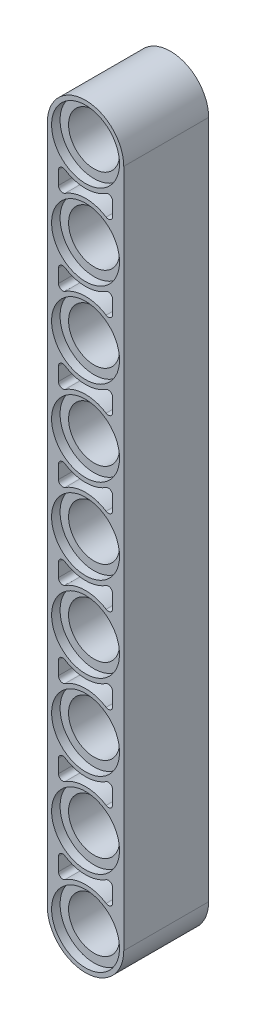
from build123d import *

# Parameters (mm, degrees)
EXTRUDE1_DEPTH      = 254
EXTRUDE1_DEPTH_BACK = 254
SKETCH108_R         = 152.4
CUT_EXTRUDE1_DEPTH  = 508
SKETCH109_R         = 203.2
CUT_EXTRUDE2_DEPTH  = 50.8
CUT_EXTRUDE3_START  = -203.2
CUT_EXTRUDE3_DEPTH  = 203.2
CUT_EXTRUDE4_START  = -457.2
SKETCH111_R         = 203.2
CUT_EXTRUDE4_DEPTH  = 50.8
CUT_EXTRUDE5_START  = -508
CUT_EXTRUDE5_DEPTH  = 203.2
SCALE1_SCALE        = 0.01574803


with BuildPart() as part:
    # Sketch107 → Extrude1 (new, two sides: drawn at the far end of the back side and taken through both)
    with BuildSketch(Plane.XY.offset(-EXTRUDE1_DEPTH_BACK)):
        with BuildLine():
            Line((-228.6, 2032), (-228.6, -2032))
            ThreePointArc((-228.6, -2032), (0, -2260.6), (228.6, -2032))
            Line((228.6, -2032), (228.6, 2032))
            ThreePointArc((228.6, 2032), (0, 2260.6), (-228.6, 2032))
        make_face()
    extrude(amount=EXTRUDE1_DEPTH + EXTRUDE1_DEPTH_BACK)

    # Sketch108 → Cut-Extrude1 (cut)
    with BuildSketch(Plane.XY.offset(254)):
        Circle(SKETCH108_R)
        with Locations((0, 508)):
            Circle(SKETCH108_R)
        with Locations((0, 1016)):
            Circle(SKETCH108_R)
        with Locations((0, 1524)):
            Circle(SKETCH108_R)
        with Locations((0, 2032)):
            Circle(SKETCH108_R)
        with Locations(Location((0, -2032, 0), (0, 0, 180))):
            Circle(SKETCH108_R)
        with Locations(Location((0, -1524, 0), (0, 0, 180))):
            Circle(SKETCH108_R)
        with Locations(Location((0, -1016, 0), (0, 0, 180))):
            Circle(SKETCH108_R)
        with Locations(Location((0, -508, 0), (0, 0, 180))):
            Circle(SKETCH108_R)
    extrude(amount=-CUT_EXTRUDE1_DEPTH, mode=Mode.SUBTRACT)

    # Sketch109 → Cut-Extrude2 (cut)
    with BuildSketch(Plane.XY.offset(254)):
        Circle(SKETCH109_R)
        with Locations((0, 508)):
            Circle(SKETCH109_R)
        with Locations((0, 1016)):
            Circle(SKETCH109_R)
        with Locations((0, 1524)):
            Circle(SKETCH109_R)
        with Locations((0, 2032)):
            Circle(SKETCH109_R)
        with Locations(Location((0, -2032, 0), (0, 0, 180))):
            Circle(SKETCH109_R)
        with Locations(Location((0, -1524, 0), (0, 0, 180))):
            Circle(SKETCH109_R)
        with Locations(Location((0, -1016, 0), (0, 0, 180))):
            Circle(SKETCH109_R)
        with Locations(Location((0, -508, 0), (0, 0, 180))):
            Circle(SKETCH109_R)
    extrude(amount=-CUT_EXTRUDE2_DEPTH, mode=Mode.SUBTRACT)

    # Sketch110 → Cut-Extrude3 (cut)
    with BuildSketch(Plane.XY.offset(254).offset(CUT_EXTRUDE3_START)):
        with BuildLine():
            Line((-162, -1817.858831609), (-162, -1738.141168391))
            ThreePointArc((-162, -1738.141168391), (-148.810569192, -1715.868719042), (-122.94, -1716.727051552))
            ThreePointArc((-122.94, -1716.727051552), (0, -1752.6), (122.94, -1716.727051552))
            ThreePointArc((122.94, -1716.727051552), (148.810569192, -1715.868719042), (162, -1738.141168391))
            Line((162, -1738.141168391), (162, -1817.858831609))
            ThreePointArc((162, -1817.858831609), (148.810569192, -1840.131280958), (122.94, -1839.272948448))
            ThreePointArc((122.94, -1839.272948448), (0, -1803.4), (-122.94, -1839.272948448))
            ThreePointArc((-122.94, -1839.272948448), (-148.810569192, -1840.131280958), (-162, -1817.858831609))
        make_face()
        with BuildLine():
            Line((162, -1309.858831609), (162, -1230.141168391))
            ThreePointArc((162, -1230.141168391), (148.810569192, -1207.868719042), (122.94, -1208.727051552))
            ThreePointArc((122.94, -1208.727051552), (0, -1244.6), (-122.94, -1208.727051552))
            ThreePointArc((-122.94, -1208.727051552), (-148.810569192, -1207.868719042), (-162, -1230.141168391))
            Line((-162, -1230.141168391), (-162, -1309.858831609))
            ThreePointArc((-162, -1309.858831609), (-148.810569192, -1332.131280958), (-122.94, -1331.272948448))
            ThreePointArc((-122.94, -1331.272948448), (0, -1295.4), (122.94, -1331.272948448))
            ThreePointArc((122.94, -1331.272948448), (148.810569192, -1332.131280958), (162, -1309.858831609))
        make_face()
        with BuildLine():
            Line((-162, 214.141168391), (-162, 293.858831609))
            ThreePointArc((-162, 293.858831609), (-148.810569192, 316.131280958), (-122.94, 315.272948448))
            ThreePointArc((-122.94, 315.272948448), (0, 279.4), (122.94, 315.272948448))
            ThreePointArc((122.94, 315.272948448), (148.810569192, 316.131280958), (162, 293.858831609))
            Line((162, 293.858831609), (162, 214.141168391))
            ThreePointArc((162, 214.141168391), (148.810569192, 191.868719042), (122.94, 192.727051552))
            ThreePointArc((122.94, 192.727051552), (0, 228.6), (-122.94, 192.727051552))
            ThreePointArc((-122.94, 192.727051552), (-148.810569192, 191.868719042), (-162, 214.141168391))
        make_face()
        with BuildLine():
            Line((-162, -722.141168391), (-162, -801.858831609))
            ThreePointArc((-162, -801.858831609), (-148.810569192, -824.131280958), (-122.94, -823.272948448))
            ThreePointArc((-122.94, -823.272948448), (0, -787.4), (122.94, -823.272948448))
            ThreePointArc((122.94, -823.272948448), (148.810569192, -824.131280958), (162, -801.858831609))
            Line((162, -801.858831609), (162, -722.141168391))
            ThreePointArc((162, -722.141168391), (148.810569192, -699.868719042), (122.94, -700.727051552))
            ThreePointArc((122.94, -700.727051552), (0, -736.6), (-122.94, -700.727051552))
            ThreePointArc((-122.94, -700.727051552), (-148.810569192, -699.868719042), (-162, -722.141168391))
        make_face()
        with BuildLine():
            Line((162, -214.141168391), (162, -293.858831609))
            ThreePointArc((162, -293.858831609), (148.810569192, -316.131280958), (122.94, -315.272948448))
            ThreePointArc((122.94, -315.272948448), (0, -279.4), (-122.94, -315.272948448))
            ThreePointArc((-122.94, -315.272948448), (-148.810569192, -316.131280958), (-162, -293.858831609))
            Line((-162, -293.858831609), (-162, -214.141168391))
            ThreePointArc((-162, -214.141168391), (-148.810569192, -191.868719042), (-122.94, -192.727051552))
            ThreePointArc((-122.94, -192.727051552), (0, -228.6), (122.94, -192.727051552))
            ThreePointArc((122.94, -192.727051552), (148.810569192, -191.868719042), (162, -214.141168391))
        make_face()
        with BuildLine():
            Line((162, 722.141168391), (162, 801.858831609))
            ThreePointArc((162, 801.858831609), (148.810569192, 824.131280958), (122.94, 823.272948448))
            ThreePointArc((122.94, 823.272948448), (0, 787.4), (-122.94, 823.272948448))
            ThreePointArc((-122.94, 823.272948448), (-148.810569192, 824.131280958), (-162, 801.858831609))
            Line((-162, 801.858831609), (-162, 722.141168391))
            ThreePointArc((-162, 722.141168391), (-148.810569192, 699.868719042), (-122.94, 700.727051552))
            ThreePointArc((-122.94, 700.727051552), (0, 736.6), (122.94, 700.727051552))
            ThreePointArc((122.94, 700.727051552), (148.810569192, 699.868719042), (162, 722.141168391))
        make_face()
        with BuildLine():
            Line((-162, 1309.858831609), (-162, 1230.141168391))
            ThreePointArc((-162, 1230.141168391), (-148.810569192, 1207.868719042), (-122.94, 1208.727051552))
            ThreePointArc((-122.94, 1208.727051552), (0, 1244.6), (122.94, 1208.727051552))
            ThreePointArc((122.94, 1208.727051552), (148.810569192, 1207.868719042), (162, 1230.141168391))
            Line((162, 1230.141168391), (162, 1309.858831609))
            ThreePointArc((162, 1309.858831609), (148.810569192, 1332.131280958), (122.94, 1331.272948448))
            ThreePointArc((122.94, 1331.272948448), (0, 1295.4), (-122.94, 1331.272948448))
            ThreePointArc((-122.94, 1331.272948448), (-148.810569192, 1332.131280958), (-162, 1309.858831609))
        make_face()
        with BuildLine():
            Line((162, 1817.858831609), (162, 1738.141168391))
            ThreePointArc((162, 1738.141168391), (148.810569192, 1715.868719042), (122.94, 1716.727051552))
            ThreePointArc((122.94, 1716.727051552), (0, 1752.6), (-122.94, 1716.727051552))
            ThreePointArc((-122.94, 1716.727051552), (-148.810569192, 1715.868719042), (-162, 1738.141168391))
            Line((-162, 1738.141168391), (-162, 1817.858831609))
            ThreePointArc((-162, 1817.858831609), (-148.810569192, 1840.131280958), (-122.94, 1839.272948448))
            ThreePointArc((-122.94, 1839.272948448), (0, 1803.4), (122.94, 1839.272948448))
            ThreePointArc((122.94, 1839.272948448), (148.810569192, 1840.131280958), (162, 1817.858831609))
        make_face()
    extrude(amount=CUT_EXTRUDE3_DEPTH, mode=Mode.SUBTRACT)

    # Sketch111 → Cut-Extrude4 (cut)
    with BuildSketch(Plane.XY.offset(254).offset(CUT_EXTRUDE4_START)):
        Circle(SKETCH111_R)
        with Locations((0, 508)):
            Circle(SKETCH111_R)
        with Locations((0, 1016)):
            Circle(SKETCH111_R)
        with Locations((0, 1524)):
            Circle(SKETCH111_R)
        with Locations((0, 2032)):
            Circle(SKETCH111_R)
        with Locations(Location((0, -2032, 0), (0, 0, 180))):
            Circle(SKETCH111_R)
        with Locations(Location((0, -1524, 0), (0, 0, 180))):
            Circle(SKETCH111_R)
        with Locations(Location((0, -1016, 0), (0, 0, 180))):
            Circle(SKETCH111_R)
        with Locations(Location((0, -508, 0), (0, 0, 180))):
            Circle(SKETCH111_R)
    extrude(amount=-CUT_EXTRUDE4_DEPTH, mode=Mode.SUBTRACT)

    # Sketch112 → Cut-Extrude5 (cut)
    with BuildSketch(Plane.XY.offset(254).offset(CUT_EXTRUDE5_START)):
        with BuildLine():
            Line((-162, -1817.858831609), (-162, -1738.141168391))
            ThreePointArc((-162, -1738.141168391), (-148.810569192, -1715.868719042), (-122.94, -1716.727051552))
            ThreePointArc((-122.94, -1716.727051552), (0, -1752.6), (122.94, -1716.727051552))
            ThreePointArc((122.94, -1716.727051552), (148.810569192, -1715.868719042), (162, -1738.141168391))
            Line((162, -1738.141168391), (162, -1817.858831609))
            ThreePointArc((162, -1817.858831609), (148.810569192, -1840.131280958), (122.94, -1839.272948448))
            ThreePointArc((122.94, -1839.272948448), (0, -1803.4), (-122.94, -1839.272948448))
            ThreePointArc((-122.94, -1839.272948448), (-148.810569192, -1840.131280958), (-162, -1817.858831609))
        make_face()
        with BuildLine():
            Line((162, -1309.858831609), (162, -1230.141168391))
            ThreePointArc((162, -1230.141168391), (148.810569192, -1207.868719042), (122.94, -1208.727051552))
            ThreePointArc((122.94, -1208.727051552), (0, -1244.6), (-122.94, -1208.727051552))
            ThreePointArc((-122.94, -1208.727051552), (-148.810569192, -1207.868719042), (-162, -1230.141168391))
            Line((-162, -1230.141168391), (-162, -1309.858831609))
            ThreePointArc((-162, -1309.858831609), (-148.810569192, -1332.131280958), (-122.94, -1331.272948448))
            ThreePointArc((-122.94, -1331.272948448), (0, -1295.4), (122.94, -1331.272948448))
            ThreePointArc((122.94, -1331.272948448), (148.810569192, -1332.131280958), (162, -1309.858831609))
        make_face()
        with BuildLine():
            Line((-162, 214.141168391), (-162, 293.858831609))
            ThreePointArc((-162, 293.858831609), (-148.810569192, 316.131280958), (-122.94, 315.272948448))
            ThreePointArc((-122.94, 315.272948448), (0, 279.4), (122.94, 315.272948448))
            ThreePointArc((122.94, 315.272948448), (148.810569192, 316.131280958), (162, 293.858831609))
            Line((162, 293.858831609), (162, 214.141168391))
            ThreePointArc((162, 214.141168391), (148.810569192, 191.868719042), (122.94, 192.727051552))
            ThreePointArc((122.94, 192.727051552), (0, 228.6), (-122.94, 192.727051552))
            ThreePointArc((-122.94, 192.727051552), (-148.810569192, 191.868719042), (-162, 214.141168391))
        make_face()
        with BuildLine():
            Line((-162, -722.141168391), (-162, -801.858831609))
            ThreePointArc((-162, -801.858831609), (-148.810569192, -824.131280958), (-122.94, -823.272948448))
            ThreePointArc((-122.94, -823.272948448), (0, -787.4), (122.94, -823.272948448))
            ThreePointArc((122.94, -823.272948448), (148.810569192, -824.131280958), (162, -801.858831609))
            Line((162, -801.858831609), (162, -722.141168391))
            ThreePointArc((162, -722.141168391), (148.810569192, -699.868719042), (122.94, -700.727051552))
            ThreePointArc((122.94, -700.727051552), (0, -736.6), (-122.94, -700.727051552))
            ThreePointArc((-122.94, -700.727051552), (-148.810569192, -699.868719042), (-162, -722.141168391))
        make_face()
        with BuildLine():
            Line((162, -214.141168391), (162, -293.858831609))
            ThreePointArc((162, -293.858831609), (148.810569192, -316.131280958), (122.94, -315.272948448))
            ThreePointArc((122.94, -315.272948448), (0, -279.4), (-122.94, -315.272948448))
            ThreePointArc((-122.94, -315.272948448), (-148.810569192, -316.131280958), (-162, -293.858831609))
            Line((-162, -293.858831609), (-162, -214.141168391))
            ThreePointArc((-162, -214.141168391), (-148.810569192, -191.868719042), (-122.94, -192.727051552))
            ThreePointArc((-122.94, -192.727051552), (0, -228.6), (122.94, -192.727051552))
            ThreePointArc((122.94, -192.727051552), (148.810569192, -191.868719042), (162, -214.141168391))
        make_face()
        with BuildLine():
            Line((162, 722.141168391), (162, 801.858831609))
            ThreePointArc((162, 801.858831609), (148.810569192, 824.131280958), (122.94, 823.272948448))
            ThreePointArc((122.94, 823.272948448), (0, 787.4), (-122.94, 823.272948448))
            ThreePointArc((-122.94, 823.272948448), (-148.810569192, 824.131280958), (-162, 801.858831609))
            Line((-162, 801.858831609), (-162, 722.141168391))
            ThreePointArc((-162, 722.141168391), (-148.810569192, 699.868719042), (-122.94, 700.727051552))
            ThreePointArc((-122.94, 700.727051552), (0, 736.6), (122.94, 700.727051552))
            ThreePointArc((122.94, 700.727051552), (148.810569192, 699.868719042), (162, 722.141168391))
        make_face()
        with BuildLine():
            Line((-162, 1309.858831609), (-162, 1230.141168391))
            ThreePointArc((-162, 1230.141168391), (-148.810569192, 1207.868719042), (-122.94, 1208.727051552))
            ThreePointArc((-122.94, 1208.727051552), (0, 1244.6), (122.94, 1208.727051552))
            ThreePointArc((122.94, 1208.727051552), (148.810569192, 1207.868719042), (162, 1230.141168391))
            Line((162, 1230.141168391), (162, 1309.858831609))
            ThreePointArc((162, 1309.858831609), (148.810569192, 1332.131280958), (122.94, 1331.272948448))
            ThreePointArc((122.94, 1331.272948448), (0, 1295.4), (-122.94, 1331.272948448))
            ThreePointArc((-122.94, 1331.272948448), (-148.810569192, 1332.131280958), (-162, 1309.858831609))
        make_face()
        with BuildLine():
            Line((162, 1817.858831609), (162, 1738.141168391))
            ThreePointArc((162, 1738.141168391), (148.810569192, 1715.868719042), (122.94, 1716.727051552))
            ThreePointArc((122.94, 1716.727051552), (0, 1752.6), (-122.94, 1716.727051552))
            ThreePointArc((-122.94, 1716.727051552), (-148.810569192, 1715.868719042), (-162, 1738.141168391))
            Line((-162, 1738.141168391), (-162, 1817.858831609))
            ThreePointArc((-162, 1817.858831609), (-148.810569192, 1840.131280958), (-122.94, 1839.272948448))
            ThreePointArc((-122.94, 1839.272948448), (0, 1803.4), (122.94, 1839.272948448))
            ThreePointArc((122.94, 1839.272948448), (148.810569192, 1840.131280958), (162, 1817.858831609))
        make_face()
    extrude(amount=CUT_EXTRUDE5_DEPTH, mode=Mode.SUBTRACT)


with BuildPart() as part_1:
    # Scale1: scaled about (0, 0, 0)
    add(part.part.scale(SCALE1_SCALE))


solid = part_1.part
